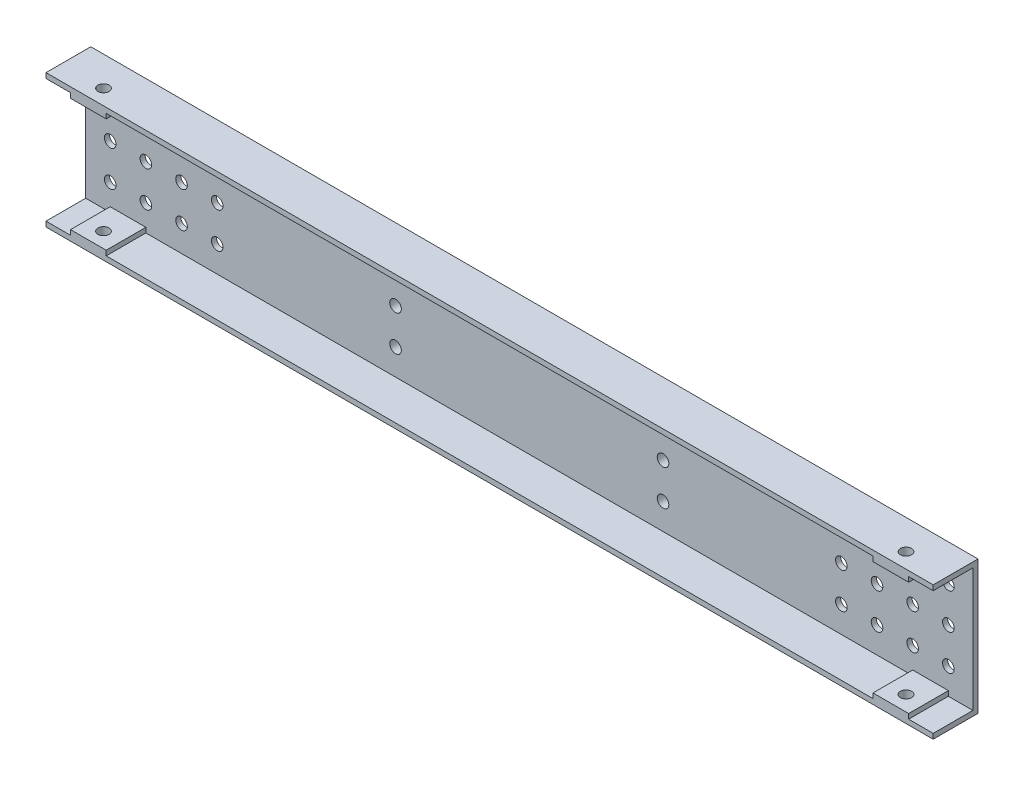
from build123d import *

# Parameters (mm, degrees)
SKETCH_1_W             = 1990
SKETCH_1_H             = 300
SKETCH_1_R             = 13
EXTRUDE_392_DEPTH      = 11.5
EXTRUDE_1_DEPTH        = 89
SKETCH_3_R             = 13
CUT_EXTRUDE_1_DEPTH    = 1045.090633039
PATTERN_LINEAR_1_COUNT = 3
PATTERN_LINEAR_1_PITCH = 80
EXTRUDE_START          = 16
SKETCH_7_W             = 70
SKETCH_7_H             = 230
SKETCH_7_R             = 13
EXTRUDE_2_DEPTH        = 16
SKETCH_8_R             = 12.5
CUT_EXTRUDE_2_DEPTH    = 1045.090633039


with BuildPart() as part:
    # 草图1 → Extrude 392 (new body)
    with BuildSketch(Plane.XY):
        with Locations((0, 150)):
            Rectangle(SKETCH_1_W, SKETCH_1_H)
        with Locations((300, 230)):
            Circle(SKETCH_1_R, mode=Mode.SUBTRACT)
        with Locations((300, 150)):
            Circle(SKETCH_1_R, mode=Mode.SUBTRACT)
        with Locations((300, 70)):
            Circle(SKETCH_1_R, mode=Mode.SUBTRACT)
        with Locations(Location((-300, 70, 0), (0, 0, 180))):
            Circle(SKETCH_1_R, mode=Mode.SUBTRACT)
        with Locations(Location((-300, 150, 0), (0, 0, 180))):
            Circle(SKETCH_1_R, mode=Mode.SUBTRACT)
        with Locations(Location((-300, 230, 0), (0, 0, 180))):
            Circle(SKETCH_1_R, mode=Mode.SUBTRACT)
    extrude(amount=EXTRUDE_392_DEPTH)

    # 草图2 → 凸台-拉伸1 (add)
    with BuildSketch(Plane.XY.offset(11.5)):
        Polygon((-995, 300), (995, 300), (995, 288.5), (940, 288.5), (940, 277.5), (860, 277.5), (860, 288.5), (-860, 288.5), (-860, 277.5), (-940, 277.5), (-940, 288.5), (-995, 288.5), align=None)
        Polygon((-995, 0), (995, 0), (995, 11.5), (940, 11.5), (940, 22.5), (860, 22.5), (860, 11.5), (-860, 11.5), (-860, 22.5), (-940, 22.5), (-940, 11.5), (-995, 11.5), align=None)
    extrude(amount=EXTRUDE_1_DEPTH)

    # 草图3 → 切除-拉伸1 (cut, through all)
    with BuildSketch(Plane(origin=(0, 0, 0), x_dir=(-1, 0, 0), z_dir=(0, 0, -1))):
        with Locations((940, 70)):
            Circle(SKETCH_3_R)
        with Locations((860, 70)):
            Circle(SKETCH_3_R)
        with Locations((780, 70)):
            Circle(SKETCH_3_R)
        with Locations((700, 70)):
            Circle(SKETCH_3_R)
        with Locations((-940, 70)):
            Circle(SKETCH_3_R)
        with Locations((-860, 70)):
            Circle(SKETCH_3_R)
        with Locations((-780, 70)):
            Circle(SKETCH_3_R)
        with Locations((-700, 70)):
            Circle(SKETCH_3_R)
    cut_extrude_1 = extrude(amount=-CUT_EXTRUDE_1_DEPTH, mode=Mode.SUBTRACT)

    # 阵列(线性)1: 切除-拉伸1 ×3
    with Locations(*[(0, i * PATTERN_LINEAR_1_PITCH, 0) for i in range(1, PATTERN_LINEAR_1_COUNT)]):
        add(cut_extrude_1, mode=Mode.SUBTRACT)

    # 草图7 → 凸台-拉伸2 (add)
    # profile 1 of 2: a face of its own
    with BuildSketch(Plane(origin=(0, 0, 0), x_dir=(-1, 0, 0), z_dir=(0, 0, -1)).offset(EXTRUDE_START)):
        with Locations((300, 150)):
            Rectangle(SKETCH_7_W, SKETCH_7_H)
        with Locations((300, 230)):
            Circle(SKETCH_7_R, mode=Mode.SUBTRACT)
        with Locations((300, 150)):
            Circle(SKETCH_7_R, mode=Mode.SUBTRACT)
        with Locations((300, 70)):
            Circle(SKETCH_7_R, mode=Mode.SUBTRACT)
    # profile 2 of 2: a face of its own
    with BuildSketch(Plane(origin=(0, 0, 0), x_dir=(-1, 0, 0), z_dir=(0, 0, -1)).offset(EXTRUDE_START)):
        with Locations((-300, 150)):
            Rectangle(SKETCH_7_W, SKETCH_7_H)
        with Locations(Location((-300, 70, 0), (0, 0, 180))):
            Circle(SKETCH_7_R, mode=Mode.SUBTRACT)
        with Locations(Location((-300, 150, 0), (0, 0, 180))):
            Circle(SKETCH_7_R, mode=Mode.SUBTRACT)
        with Locations(Location((-300, 230, 0), (0, 0, 180))):
            Circle(SKETCH_7_R, mode=Mode.SUBTRACT)
    extrude(amount=-EXTRUDE_2_DEPTH)

    # 草图8 → 切除-拉伸2 (cut, through all)
    with BuildSketch(Plane(origin=(0, 300, 0), x_dir=(-1, 0, 0), z_dir=(0, 1, 0))):
        with Locations(Location((900, 66.5, 0), (0, 0, 90))):
            Circle(SKETCH_8_R)
        with Locations(Location((-900, 66.5, 0), (0, 0, 270))):
            Circle(SKETCH_8_R)
    extrude(amount=-CUT_EXTRUDE_2_DEPTH, mode=Mode.SUBTRACT)


solid = part.part
